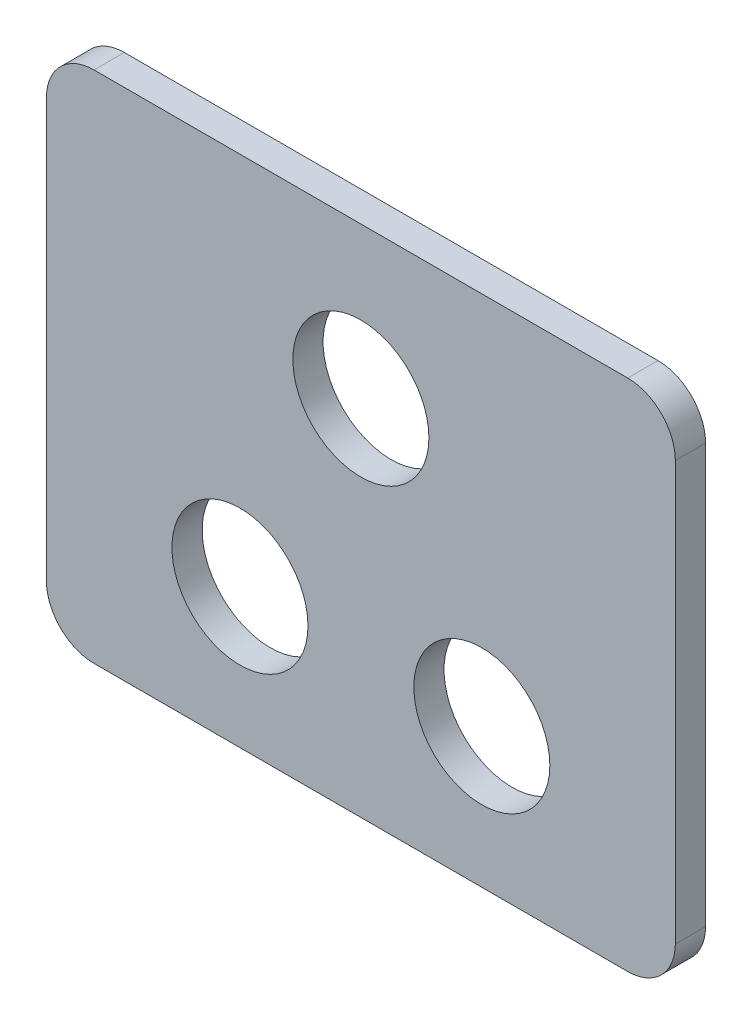
from build123d import *
from build123d.topology import SkipClean

# Parameters (mm, degrees)
SKETCH1_R           = 14.2875
SKETCH1_R_2         = 53.34
BOSS_EXTRUDE1_DEPTH = 6.35


with BuildPart() as part:
    # Sketch1 → Boss-Extrude1 (new body)
    # profile 1 of 2: a face of its own
    with SkipClean():  # the faces are left unmerged after this step: merging them gives an invalid solid
        with BuildSketch(Plane.XY):
            with BuildLine():
                Line((-80.017343047, -25.364503898), (32.062656953, -25.364503898))
                ThreePointArc((32.062656953, -25.364503898), (39.133724765, -28.293436086), (42.062656953, -35.364503898))
                Line((42.062656953, -35.364503898), (42.062656953, -123.314503898))
                ThreePointArc((42.062656953, -123.314503898), (39.133724765, -130.38557171), (32.062656953, -133.314503898))
                Line((32.062656953, -133.314503898), (-80.017343047, -133.314503898))
                ThreePointArc((-80.017343047, -133.314503898), (-87.088410859, -130.38557171), (-90.017343047, -123.314503898))
                Line((-90.017343047, -123.314503898), (-90.017343047, -35.364503898))
                ThreePointArc((-90.017343047, -35.364503898), (-87.088410859, -28.293436086), (-80.017343047, -25.364503898))
            make_face()
            with Locations((-49.377343047, -104.018614592)):
                Circle(SKETCH1_R, mode=Mode.SUBTRACT)
            with Locations((-23.977343047, -57.114503898)):
                Circle(SKETCH1_R_2, mode=Mode.SUBTRACT)
            with Locations((1.422656953, -104.018614592)):
                Circle(SKETCH1_R, mode=Mode.SUBTRACT)
        # profile 2 of 2: a face of its own
        with BuildSketch(Plane.XY):
            with BuildLine():
                Line((18.883981011, -25.364503898), (-66.838667105, -25.364503898))
                ThreePointArc((-66.838667105, -25.364503898), (-77.128704465, -61.596510075), (-60.916565887, -95.593711477))
                ThreePointArc((-60.916565887, -95.593711477), (-44.94642836, -90.435549721), (-35.089843047, -104.018614592))
                ThreePointArc((-35.089843047, -104.018614592), (-35.3232221, -106.59045064), (-36.015735002, -109.078267418))
                ThreePointArc((-36.015735002, -109.078267418), (-23.977343047, -110.454503898), (-11.938951091, -109.078267418))
                ThreePointArc((-11.938951091, -109.078267418), (-5.380914475, -91.455013513), (12.961879794, -95.593711477))
                ThreePointArc((12.961879794, -95.593711477), (25.091454301, -78.028822602), (29.362656953, -57.114503898))
                ThreePointArc((29.362656953, -57.114503898), (26.67529077, -40.397258689), (18.883981011, -25.364503898))
            make_face()
            with Locations((-23.977343047, -57.114503898)):
                Circle(SKETCH1_R, mode=Mode.SUBTRACT)
        extrude(amount=BOSS_EXTRUDE1_DEPTH)


solid = part.part
